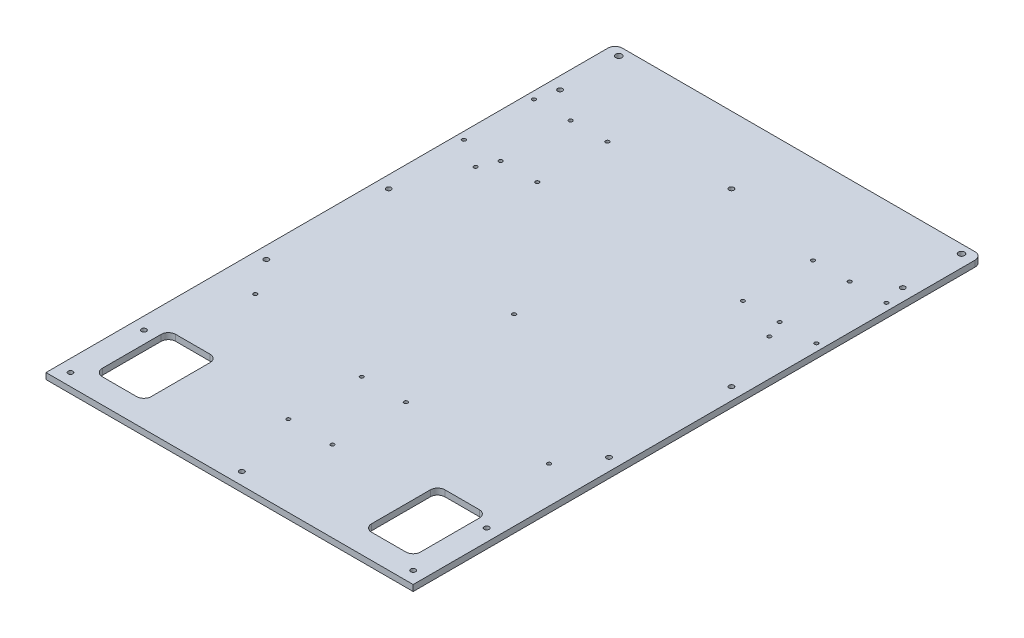
from build123d import *

# Parameters (mm, degrees)
SKETCH1_R           = 2
SKETCH1_W           = 40
SKETCH1_H           = 60
SKETCH1_R_2         = 1.5
SKETCH1_R_3         = 2.5
BOSS_EXTRUDE1_DEPTH = 5
FILLET1_R           = 6
SKETCH2_R           = 1.5
CUT_EXTRUDE1_DEPTH  = 296.88849251


with BuildPart() as part:
    # Sketch1 → Boss-Extrude1 (new body)
    with BuildSketch(Plane(origin=(0, 0, 0), x_dir=(1, 0, 0), z_dir=(0, 1, 0))):
        Polygon((-150, 210), (-150, -210), (150, -210), (150, 210), (150, 255), (-150, 255), align=None)
        with Locations(Location((-140, -200, 0), (0, 0, 270))):
            Circle(SKETCH1_R, mode=Mode.SUBTRACT)
        with Locations((-110, -160)):
            Rectangle(SKETCH1_W, SKETCH1_H, mode=Mode.SUBTRACT)
        with Locations(Location((-140, -140, 0), (0, 0, 270))):
            Circle(SKETCH1_R, mode=Mode.SUBTRACT)
        with Locations(Location((-140, -40, 0), (0, 0, 270))):
            Circle(SKETCH1_R, mode=Mode.SUBTRACT)
        with Locations(Location((0, -200, 0), (0, 0, 270))):
            Circle(SKETCH1_R, mode=Mode.SUBTRACT)
        with Locations((110, -160)):
            Rectangle(SKETCH1_W, SKETCH1_H, mode=Mode.SUBTRACT)
        with Locations(Location((140, -200, 0), (0, 0, 270))):
            Circle(SKETCH1_R, mode=Mode.SUBTRACT)
        with Locations(Location((140, -140, 0), (0, 0, 270))):
            Circle(SKETCH1_R, mode=Mode.SUBTRACT)
        with Locations(Location((140, -40, 0), (0, 0, 270))):
            Circle(SKETCH1_R, mode=Mode.SUBTRACT)
        with Locations(Location((-140, 60, 0), (0, 0, 270))):
            Circle(SKETCH1_R, mode=Mode.SUBTRACT)
        with Locations(Location((-144, 125.375, 0), (0, 0, 270))):
            Circle(SKETCH1_R_2, mode=Mode.SUBTRACT)
        with Locations(Location((-114, 125.375, 0), (0, 0, 270))):
            Circle(SKETCH1_R_2, mode=Mode.SUBTRACT)
        with Locations(Location((-84, 125.375, 0), (0, 0, 270))):
            Circle(SKETCH1_R_2, mode=Mode.SUBTRACT)
        with Locations(Location((-144, 182.625, 0), (0, 0, 270))):
            Circle(SKETCH1_R_2, mode=Mode.SUBTRACT)
        with Locations(Location((-114, 182.625, 0), (0, 0, 270))):
            Circle(SKETCH1_R_2, mode=Mode.SUBTRACT)
        with Locations(Location((-84, 182.625, 0), (0, 0, 270))):
            Circle(SKETCH1_R_2, mode=Mode.SUBTRACT)
        with Locations(Location((-140, 200, 0), (0, 0, 270))):
            Circle(SKETCH1_R, mode=Mode.SUBTRACT)
        with Locations(Location((-140, 248, 0), (0, 0, 270))):
            Circle(SKETCH1_R_3, mode=Mode.SUBTRACT)
        with Locations(Location((140, 60, 0), (0, 0, 270))):
            Circle(SKETCH1_R, mode=Mode.SUBTRACT)
        with Locations(Location((84, 125.375, 0), (0, 0, 270))):
            Circle(SKETCH1_R_2, mode=Mode.SUBTRACT)
        with Locations(Location((114, 125.375, 0), (0, 0, 270))):
            Circle(SKETCH1_R_2, mode=Mode.SUBTRACT)
        with Locations(Location((144, 125.375, 0), (0, 0, 270))):
            Circle(SKETCH1_R_2, mode=Mode.SUBTRACT)
        with Locations(Location((0, 200, 0), (0, 0, 270))):
            Circle(SKETCH1_R, mode=Mode.SUBTRACT)
        with Locations(Location((84, 182.625, 0), (0, 0, 270))):
            Circle(SKETCH1_R_2, mode=Mode.SUBTRACT)
        with Locations(Location((114, 182.625, 0), (0, 0, 270))):
            Circle(SKETCH1_R_2, mode=Mode.SUBTRACT)
        with Locations(Location((144, 182.625, 0), (0, 0, 270))):
            Circle(SKETCH1_R_2, mode=Mode.SUBTRACT)
        with Locations(Location((140, 200, 0), (0, 0, 270))):
            Circle(SKETCH1_R, mode=Mode.SUBTRACT)
        with Locations(Location((140, 248, 0), (0, 0, 270))):
            Circle(SKETCH1_R_3, mode=Mode.SUBTRACT)
    extrude(amount=BOSS_EXTRUDE1_DEPTH)

    # Fillet1
    fillet1_edges = [part.edges().sort_by_distance(p)[0] for p in [
        (130, 2.5, 190),
        (130, 2.5, 130),
        (90, 2.5, 130),
        (90, 2.5, 190),
        (-90, 2.5, 130),
        (-130, 2.5, 130),
        (-130, 2.5, 190),
        (-90, 2.5, 190),
        (-150, 2.5, -255),
        (150, 2.5, -255),
    ]]
    fillet(fillet1_edges, radius=FILLET1_R)

    # Sketch2 → Cut-Extrude1 (cut, through all)
    with BuildSketch(Plane(origin=(0, 5, 0), x_dir=(1, 0, 0), z_dir=(0, 1, 0))):
        with Locations(Location((-18, -144, 0), (0, 0, 270))):
            Circle(SKETCH2_R)
        with Locations(Location((18, -144, 0), (0, 0, 270))):
            Circle(SKETCH2_R)
        with Locations(Location((18, -84, 0), (0, 0, 270))):
            Circle(SKETCH2_R)
        with Locations(Location((-18, -84, 0), (0, 0, 270))):
            Circle(SKETCH2_R)
        with Locations(Location((-120, -69, 0), (0, 0, 270))):
            Circle(SKETCH2_R)
        with Locations(Location((120, -69, 0), (0, 0, 270))):
            Circle(SKETCH2_R)
        with Locations(Location((120, 111, 0), (0, 0, 270))):
            Circle(SKETCH2_R)
        with Locations(Location((-120, 111, 0), (0, 0, 270))):
            Circle(SKETCH2_R)
        with Locations(Location((0, 22.5, 0), (0, 0, 270))):
            Circle(SKETCH2_R)
    extrude(amount=-CUT_EXTRUDE1_DEPTH, mode=Mode.SUBTRACT)


solid = part.part
